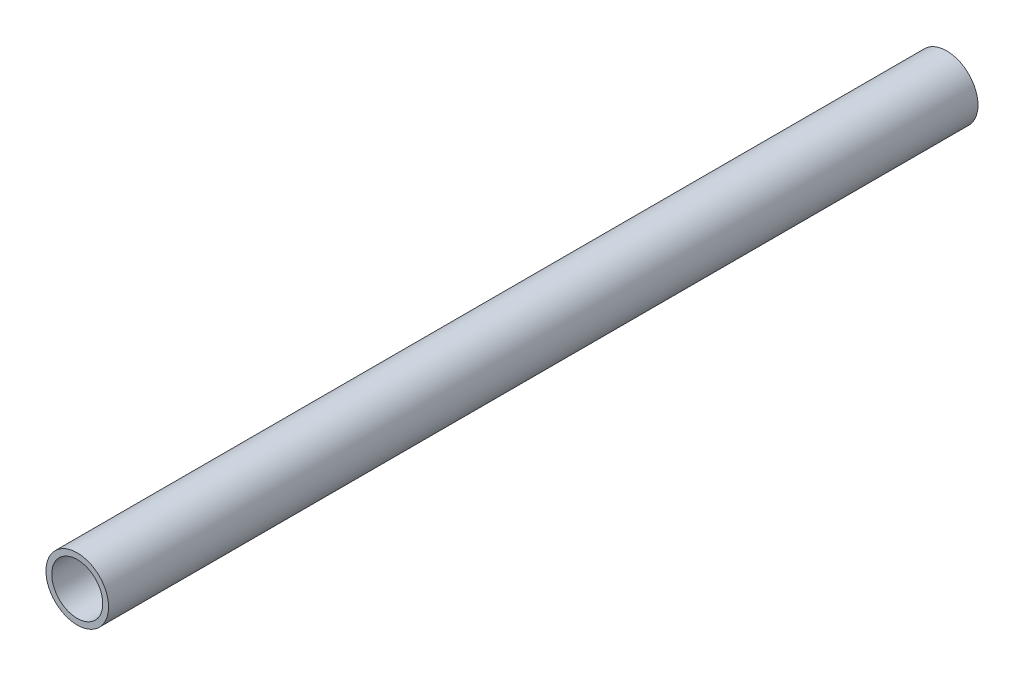
from build123d import *

# Parameters (mm, degrees)
CROQUIS1_R              = 10.8
CROQUIS1_R_2            = 8.8
SALIENTE_EXTRUIR1_DEPTH = 300


with BuildPart() as part:
    # Croquis1 → Saliente-Extruir1 (new body)
    with BuildSketch(Plane.XY):
        Circle(CROQUIS1_R)
        Circle(CROQUIS1_R_2, mode=Mode.SUBTRACT)
    extrude(amount=SALIENTE_EXTRUIR1_DEPTH)


solid = part.part
